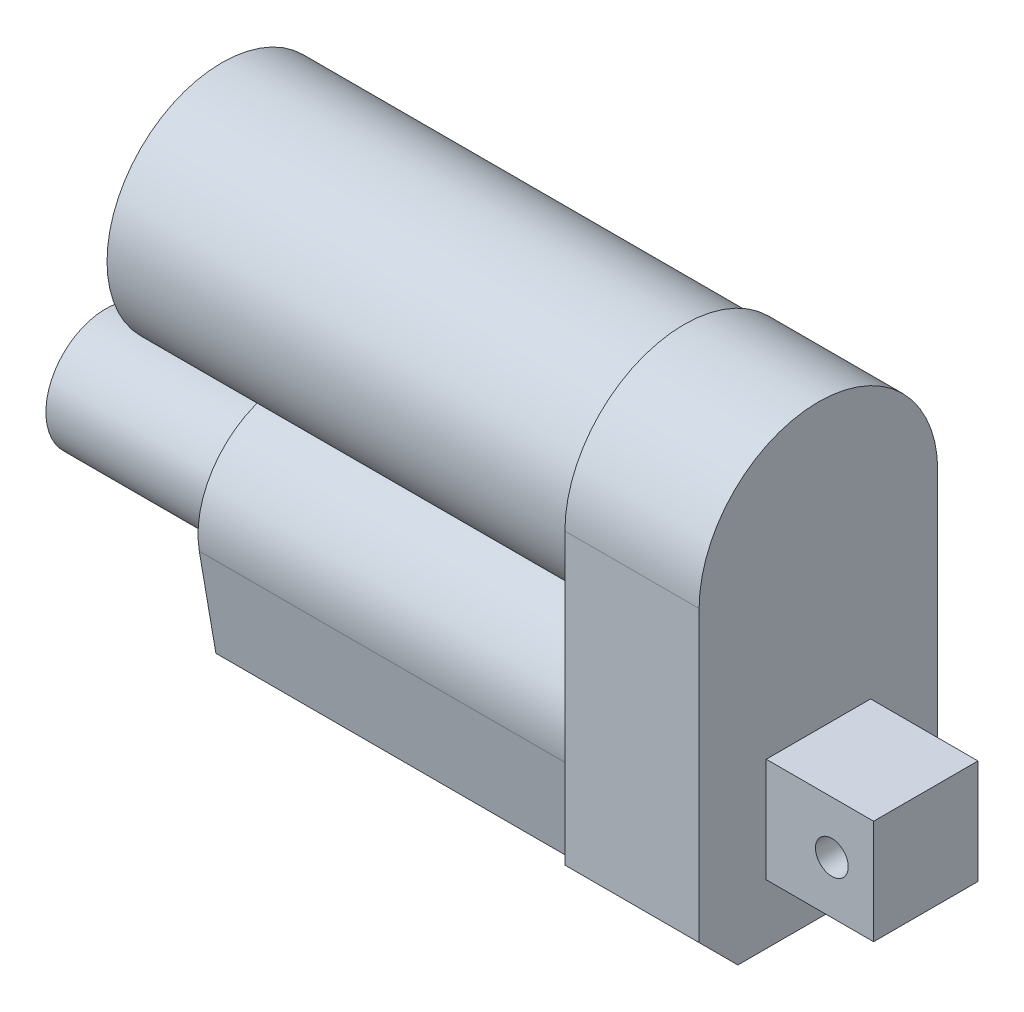
from build123d import *

# Parameters (mm, degrees)
SKETCH1_R               = 20
BOSS_EXTRUDE1_DEPTH     = 22.5
SKETCH3_W               = 17.5
SKETCH3_H               = 17.5
BOSS_EXTRUDE2_DEPTH     = 18
CUT_EXTRUDE1_DEPTH      = 76.039156445
CUT_EXTRUDE1_DEPTH_BACK = 76.039156445
SKETCH4_R               = 2.75
BOSS_EXTRUDE3_DEPTH     = 66.5
SKETCH6_R               = 19.25
BOSS_EXTRUDE4_DEPTH     = 77.5
SKETCH7_R               = 10
BOSS_EXTRUDE5_DEPTH     = 30.5


with BuildPart() as part:
    # Sketch1 → Boss-Extrude1 (new body)
    with BuildSketch(Plane(origin=(0, 0, 0), x_dir=(0, 0, -1), z_dir=(1, 0, 0))):
        with Locations((0, 36.25)):
            Circle(SKETCH1_R)
        with BuildLine():
            ThreePointArc((20, 36.25), (0, 16.25), (-20, 36.25))
            Line((-20, 36.25), (-20, -12.25))
            Line((-20, -12.25), (-13.5, -18.75))
            Line((-13.5, -18.75), (13.5, -18.75))
            Line((13.5, -18.75), (20, -12.25))
            Line((20, -12.25), (20, 36.25))
        make_face()
    extrude(amount=BOSS_EXTRUDE1_DEPTH)

    # Sketch3 → Boss-Extrude2 (add)
    with BuildSketch(Plane(origin=(22.5, 0, 0), x_dir=(0, 0, -1), z_dir=(1, 0, 0))):
        Rectangle(SKETCH3_W, SKETCH3_H)
    extrude(amount=BOSS_EXTRUDE2_DEPTH)

    # Sketch4 → Cut-Extrude1 (cut, two sides: drawn at the far end of the back side and taken through both)
    with BuildSketch(Plane.XY.offset(8.75).offset(-CUT_EXTRUDE1_DEPTH_BACK)):
        with Locations(Location((33.5, 0, 0), (0, 0, 90))):
            Circle(SKETCH4_R)
    extrude(amount=CUT_EXTRUDE1_DEPTH + CUT_EXTRUDE1_DEPTH_BACK, mode=Mode.SUBTRACT)

    # Sketch5 → Boss-Extrude3 (add)
    with BuildSketch(Plane.ZY):
        with BuildLine():
            Line((-12, -18.75), (12, -18.75))
            Line((12, -18.75), (14.783645942, -2.538466597))
            ThreePointArc((14.783645942, -2.538466597), (0, 15), (-14.783645942, -2.538466597))
            Line((-14.783645942, -2.538466597), (-12, -18.75))
        make_face()
    extrude(amount=BOSS_EXTRUDE3_DEPTH)

    # Sketch6 → Boss-Extrude4 (add)
    with BuildSketch(Plane.ZY):
        with Locations(Location((0, 36.25, 0), (0, 0, 180))):
            Circle(SKETCH6_R)
    extrude(amount=BOSS_EXTRUDE4_DEPTH)

    # Sketch7 → Boss-Extrude5 (add)
    with BuildSketch(Plane.ZY.offset(66.5)):
        with Locations(Location((0, 0, 0), (0, 0, 180))):
            Circle(SKETCH7_R)
    extrude(amount=BOSS_EXTRUDE5_DEPTH)


solid = part.part
